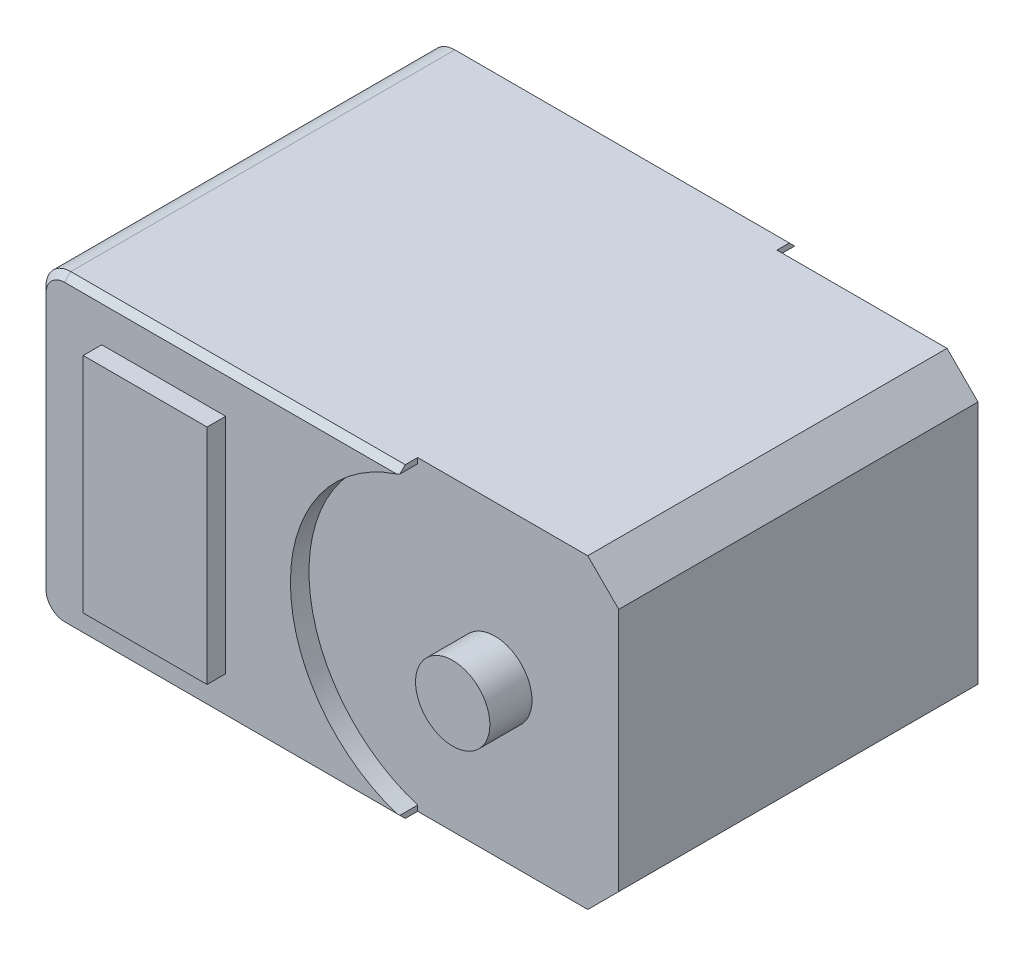
from build123d import *

# Parameters (mm, degrees)
SKETCH_1_W           = 45.23
SKETCH_1_H           = 24.73
EXTRUDE_1_DEPTH      = 35
CUT_EXTRUDE_1_DEPTH  = 3
SKETCH_5_W           = 1.897849624
SKETCH_5_H           = 24.73
CUT_EXTRUDE_3_DEPTH  = 3
EXTRUDE_2_DEPTH      = 17.9
EXTRUDE_2_DEPTH_BACK = 18.6
EXTRUDE_2_START      = 17.5
SKETCH_3_R           = 3
SKETCH_4_W           = 30.897849624
SKETCH_4_H           = 5
CUT_EXTRUDE_2_DEPTH  = 1.5
CHAMFER_1_SIZE       = 2.5
FILLET_1_R           = 2
SKETCH_6_W           = 10
SKETCH_6_H           = 18
CUT_EXTRUDE_4_DEPTH  = 1.5
CHAMFER_2_SIZE       = 0.5


with BuildPart() as part:
    # 草图1 → 凸台-拉伸1 (new body)
    with BuildSketch(Plane.XY):
        with Locations((22.615, 12.365)):
            Rectangle(SKETCH_1_W, SKETCH_1_H)
    extrude(amount=EXTRUDE_1_DEPTH)

    # 草图2 → 切除-拉伸1 (cut)
    with BuildSketch(Plane.XY):
        with BuildLine():
            Line((45.23, 24.73), (30.897849624, 24.73))
            ThreePointArc((30.897849624, 24.73), (20.23, 12.365), (30.897849624, 0))
            Line((30.897849624, 0), (45.23, 0))
            Line((45.23, 0), (45.23, 24.73))
        make_face()
    cut_extrude_1 = extrude(amount=CUT_EXTRUDE_1_DEPTH, mode=Mode.SUBTRACT)

    # 草图5 → 切除-拉伸3 (cut)
    with BuildSketch(Plane.XY):
        with Locations((29.948924812, 12.365)):
            Rectangle(SKETCH_5_W, SKETCH_5_H)
    cut_extrude_3 = extrude(amount=CUT_EXTRUDE_3_DEPTH, mode=Mode.SUBTRACT)

    # 镜向1: 切除-拉伸1, 切除-拉伸3 across plane
    add(cut_extrude_1.mirror(Plane.XY.offset(17.5)), mode=Mode.SUBTRACT)
    add(cut_extrude_3.mirror(Plane.XY.offset(17.5)), mode=Mode.SUBTRACT)

    # 草图3 → 凸台-拉伸2 (add, two sides: drawn at the far end of the back side and taken through both)
    with BuildSketch(Plane.XY.offset(EXTRUDE_2_START - EXTRUDE_2_DEPTH_BACK)):
        with Locations((35.23, 12.365)):
            Circle(SKETCH_3_R)
    extrude(amount=EXTRUDE_2_DEPTH + EXTRUDE_2_DEPTH_BACK)

    # 草图4 → 切除-拉伸2 (cut)
    with BuildSketch(Plane.XY):
        with Locations((15.448924812, 22.23)):
            Rectangle(SKETCH_4_W, SKETCH_4_H)
        with Locations((15.448924812, 2.5)):
            Rectangle(SKETCH_4_W, SKETCH_4_H)
    extrude(amount=CUT_EXTRUDE_2_DEPTH, mode=Mode.SUBTRACT)

    # 倒角1
    chamfer_1_edges = [part.edges().sort_by_distance(p)[0] for p in [
        (45.23, 0, 17.5),
        (45.23, 24.73, 17.5),
    ]]
    chamfer(chamfer_1_edges, length=CHAMFER_1_SIZE)

    # 圆角1
    fillet_1_edges = [part.edges().sort_by_distance(p)[0] for p in [
        (0, 24.73, 18.25),
        (0, 0, 18.25),
    ]]
    fillet(fillet_1_edges, radius=FILLET_1_R)

    # 草图6 → 切除-拉伸4 (cut)
    with BuildSketch(Plane.XY.offset(35)):
        with BuildLine():
            Line((29, 24.73), (2, 24.73))
            ThreePointArc((2, 24.73), (0.585786438, 24.144213562), (0, 22.73))
            Line((0, 22.73), (0, 2))
            ThreePointArc((0, 2), (0.585786438, 0.585786438), (2, 0))
            Line((2, 0), (29, 0))
            Line((29, 0), (29, 0.434488695))
            ThreePointArc((29, 0.434488695), (20.23, 12.365), (29, 24.295511305))
            Line((29, 24.295511305), (29, 24.73))
        make_face()
        with Locations((10, 12.365)):
            Rectangle(SKETCH_6_W, SKETCH_6_H, mode=Mode.SUBTRACT)
    extrude(amount=-CUT_EXTRUDE_4_DEPTH, mode=Mode.SUBTRACT)

    # 倒角2
    chamfer_2_edges = [part.edges().sort_by_distance(p)[0] for p in [
        (0, 21.23, 1.5),
        (15.5, 24.73, 1.5),
        (0, 12.365, 0),
        (0, 3.5, 1.5),
        (15.5, 0, 1.5),
        (15.5, 24.73, 33.5),
        (15.5, 0, 33.5),
    ]]
    chamfer(chamfer_2_edges, length=CHAMFER_2_SIZE)


solid = part.part
